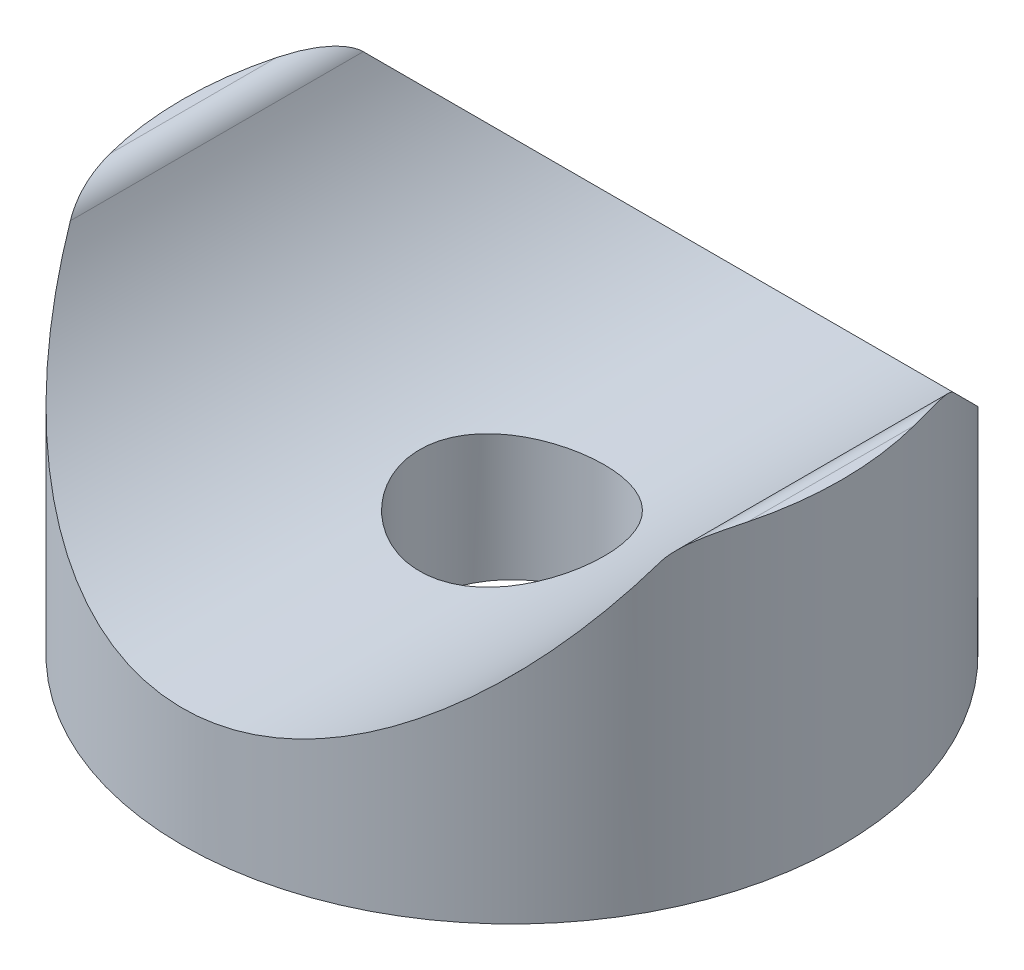
from build123d import *

# Parameters (mm, degrees)
SKETCH1_R               = 12.5
SKETCH1_R_2             = 3.5
BOSS_EXTRUDE1_DEPTH     = 12
CUT_EXTRUDE1_DEPTH      = 22
CUT_EXTRUDE1_DEPTH_BACK = 22
SKETCH2_R               = 12.5
FILLET2_R               = 1


with BuildPart() as part:
    # Sketch1 → Boss-Extrude1 (new body)
    with BuildSketch(Plane(origin=(0, 0, 0), x_dir=(1, 0, 0), z_dir=(0, 1, 0))):
        Circle(SKETCH1_R)
        Circle(SKETCH1_R_2, mode=Mode.SUBTRACT)
    extrude(amount=BOSS_EXTRUDE1_DEPTH)

    # Sketch2 → Cut-Extrude1 (cut, two sides: drawn at the far end of the back side and taken through both)
    with BuildSketch(Plane.XY.offset(-CUT_EXTRUDE1_DEPTH_BACK)):
        with Locations((0, 17)):
            Circle(SKETCH2_R)
    extrude(amount=CUT_EXTRUDE1_DEPTH + CUT_EXTRUDE1_DEPTH_BACK, mode=Mode.SUBTRACT)

    # Fillet2
    fillet2_edges = [part.edges().sort_by_distance(p)[0] for p in [
        (11.456439237, 12, 0),
        (-11.456439237, 12, 0),
    ]]
    fillet(fillet2_edges, radius=FILLET2_R)


solid = part.part
